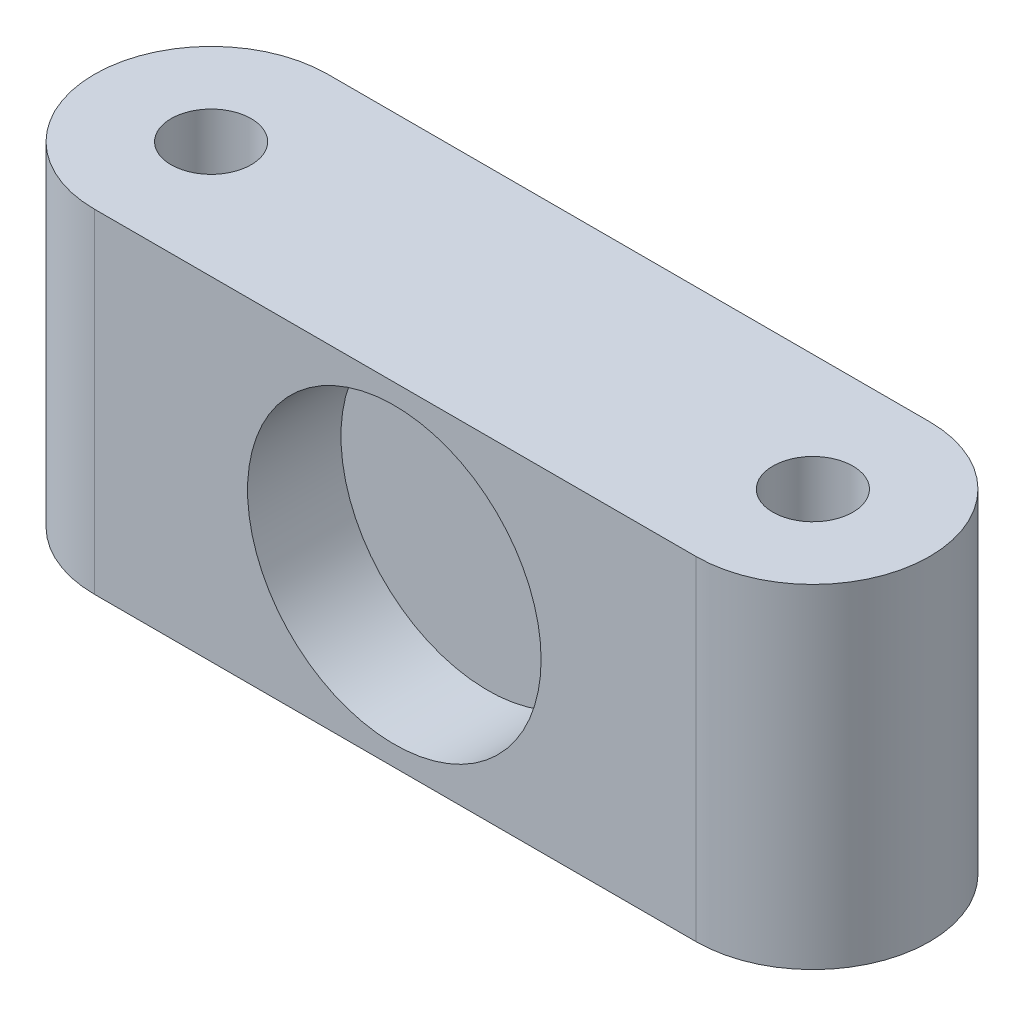
from build123d import *

# Parameters (mm, degrees)
SKETCH1_R           = 3
BOSS_EXTRUDE1_DEPTH = 25
SKETCH3_R           = 11
CUT_EXTRUDE1_DEPTH  = 7
BOSS_EXTRUDE2_START = -1.5
BOSS_EXTRUDE2_DEPTH = 1.5
BOSS_EXTRUDE3_START = -1.5
BOSS_EXTRUDE3_DEPTH = 1.5


with BuildPart() as part:
    # Sketch1 → Boss-Extrude1 (new body)
    with BuildSketch(Plane(origin=(0, 0, 0), x_dir=(1, 0, 0), z_dir=(0, 1, 0))):
        with BuildLine():
            Line((-22.480683045, -8.968703758), (22.619316955, -8.968703758))
            ThreePointArc((22.619316955, -8.968703758), (31.369316462, -0.218703512), (22.619316462, 8.531296242))
            Line((22.619316462, 8.531296242), (-22.480682552, 8.531296242))
            ThreePointArc((-22.480682552, 8.531296242), (-31.230682552, -0.218703512), (-22.480683045, -8.968703758))
        make_face()
        with Locations(Location((-22.480682552, -0.218703758, 0), (0, 0, 270))):
            Circle(SKETCH1_R, mode=Mode.SUBTRACT)
        with Locations(Location((22.619316462, -0.218703758, 0), (0, 0, 270))):
            Circle(SKETCH1_R, mode=Mode.SUBTRACT)
    extrude(amount=BOSS_EXTRUDE1_DEPTH)

    # Sketch3 → Cut-Extrude1 (cut)
    with BuildSketch(Plane.XY.offset(8.968703758)):
        with Locations((0, 12.5)):
            Circle(SKETCH3_R)
    extrude(amount=-CUT_EXTRUDE1_DEPTH, mode=Mode.SUBTRACT)

    # Sketch4 → Boss-Extrude2 (add)
    with BuildSketch(Plane(origin=(0, 9.8, 0), x_dir=(1, 0, 0), z_dir=(0, 1, 0)).offset(BOSS_EXTRUDE2_START)):
        with BuildLine():
            Line((-20.730682552, 2.217994828), (-20.730682552, 1.531296242))
            Line((-20.730682552, 1.531296242), (-20.043983966, 1.531296242))
            ThreePointArc((-20.043983966, 1.531296242), (-19.480682552, -0.218703758), (-20.043983966, -1.968703758))
            Line((-20.043983966, -1.968703758), (-20.730682552, -1.968703758))
            Line((-20.730682552, -1.968703758), (-20.730682552, -2.655402344))
            ThreePointArc((-20.730682552, -2.655402344), (-22.480682552, -3.218703758), (-24.230682552, -2.655402344))
            Line((-24.230682552, -2.655402344), (-24.230682552, -1.968703758))
            Line((-24.230682552, -1.968703758), (-24.917381138, -1.968703758))
            ThreePointArc((-24.917381138, -1.968703758), (-25.480682552, -0.218703758), (-24.917381138, 1.531296242))
            Line((-24.917381138, 1.531296242), (-24.230682552, 1.531296242))
            Line((-24.230682552, 1.531296242), (-24.230682552, 2.217994828))
            ThreePointArc((-24.230682552, 2.217994828), (-22.480682552, 2.781296242), (-20.730682552, 2.217994828))
        make_face()
    extrude(amount=BOSS_EXTRUDE2_DEPTH)

    # Sketch5 → Boss-Extrude3 (add)
    with BuildSketch(Plane(origin=(0, 9.8, 0), x_dir=(1, 0, 0), z_dir=(0, 1, 0)).offset(BOSS_EXTRUDE3_START)):
        with BuildLine():
            Line((24.369316462, 2.217994828), (24.369316462, 1.531296242))
            Line((24.369316462, 1.531296242), (25.056015049, 1.531296242))
            ThreePointArc((25.056015049, 1.531296242), (25.619316462, -0.218703758), (25.056015049, -1.968703758))
            Line((25.056015049, -1.968703758), (24.369316462, -1.968703758))
            Line((24.369316462, -1.968703758), (24.369316462, -2.655402344))
            ThreePointArc((24.369316462, -2.655402344), (22.619316462, -3.218703758), (20.869316462, -2.655402344))
            Line((20.869316462, -2.655402344), (20.869316462, -1.968703758))
            Line((20.869316462, -1.968703758), (20.182617876, -1.968703758))
            ThreePointArc((20.182617876, -1.968703758), (19.619316462, -0.218703758), (20.182617876, 1.531296242))
            Line((20.182617876, 1.531296242), (20.869316462, 1.531296242))
            Line((20.869316462, 1.531296242), (20.869316462, 2.217994828))
            ThreePointArc((20.869316462, 2.217994828), (22.619316462, 2.781296242), (24.369316462, 2.217994828))
        make_face()
    extrude(amount=BOSS_EXTRUDE3_DEPTH)


solid = part.part
